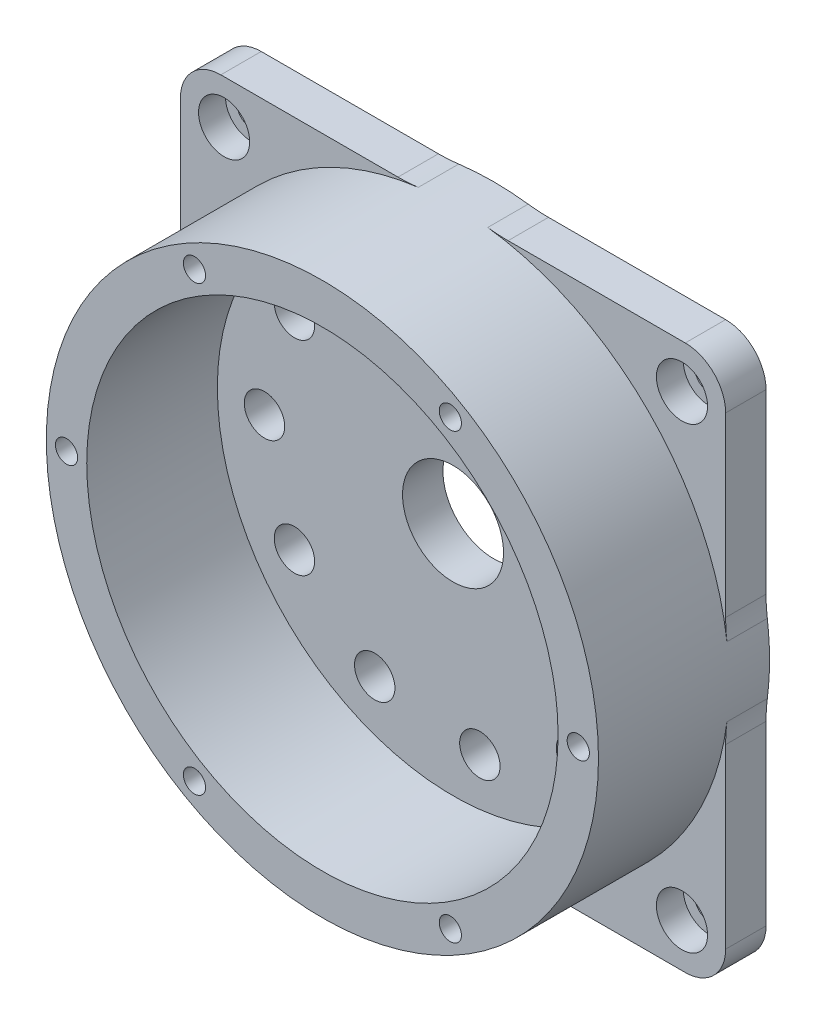
from build123d import *

# Parameters (mm, degrees)
SKETCH1_R                                    = 41
SKETCH1_R_2                                  = 3
BOSS_EXTRUDE1_DEPTH                          = 6
BOSS_EXTRUDE2_START                          = 19.4
SKETCH3_R                                    = 41
SKETCH3_R_2                                  = 35
BOSS_EXTRUDE2_DEPTH                          = 19.4
SKETCH5_R                                    = 7.5
CUT_EXTRUDE1_DEPTH                           = 62.142129502
SKETCH6_R                                    = 1.65
CUT_EXTRUDE2_DEPTH                           = 10
BOSS_EXTRUDE3_START                          = -6
SKETCH7_R                                    = 2.1
BOSS_EXTRUDE3_DEPTH                          = 6
FILLET1_R                                    = 6
FILLET2_R                                    = 24
CBORE_FOR_M4_HEX_HEAD_CAP_SCREW1_D           = 4.2
CBORE_FOR_M4_HEX_HEAD_CAP_SCREW1_CBORE_D     = 7.6
CBORE_FOR_M4_HEX_HEAD_CAP_SCREW1_CBORE_DEPTH = 4
CIRPATTERN1_COUNT                            = 4
FILLET1_OF_CIRPATTERN1_R                     = 6
FILLET2_OF_CIRPATTERN1_R                     = 24


with BuildPart() as part:
    # Sketch1 → Boss-Extrude1 (new body)
    with BuildSketch(Plane(origin=(0, 0, 0), x_dir=(0, 1, 0), z_dir=(0, 0, 1))):
        with Locations(Location((0, 0, 0), (0, 0, 270))):
            Circle(SKETCH1_R)
        with Locations(Location((0, 28, 0), (0, 0, 270))):
            Circle(SKETCH1_R_2, mode=Mode.SUBTRACT)
        with Locations(Location((15.137942889, 23.555098919, 0), (0, 0, 270))):
            Circle(SKETCH1_R_2, mode=Mode.SUBTRACT)
        with Locations(Location((25.46969587, 11.631620364, 0), (0, 0, 270))):
            Circle(SKETCH1_R_2, mode=Mode.SUBTRACT)
        with Locations(Location((27.715000373, -3.984815472, 0), (0, 0, 270))):
            Circle(SKETCH1_R_2, mode=Mode.SUBTRACT)
        with Locations(Location((21.160988082, -18.33610055, 0), (0, 0, 270))):
            Circle(SKETCH1_R_2, mode=Mode.SUBTRACT)
        with Locations(Location((7.888511592, -26.865803261, 0), (0, 0, 270))):
            Circle(SKETCH1_R_2, mode=Mode.SUBTRACT)
        with Locations(Location((-7.888511592, -26.865803261, 0), (0, 0, 270))):
            Circle(SKETCH1_R_2, mode=Mode.SUBTRACT)
        with Locations(Location((-21.160988082, -18.33610055, 0), (0, 0, 270))):
            Circle(SKETCH1_R_2, mode=Mode.SUBTRACT)
        with Locations(Location((-27.715000373, -3.984815472, 0), (0, 0, 270))):
            Circle(SKETCH1_R_2, mode=Mode.SUBTRACT)
        with Locations(Location((-25.46969587, 11.631620364, 0), (0, 0, 270))):
            Circle(SKETCH1_R_2, mode=Mode.SUBTRACT)
        with Locations(Location((-15.137942889, 23.555098919, 0), (0, 0, 270))):
            Circle(SKETCH1_R_2, mode=Mode.SUBTRACT)
    extrude(amount=-BOSS_EXTRUDE1_DEPTH)

    # Sketch3 → Boss-Extrude2 (add)
    with BuildSketch(Plane.XY.offset(BOSS_EXTRUDE2_START)):
        Circle(SKETCH3_R)
        Circle(SKETCH3_R_2, mode=Mode.SUBTRACT)
    extrude(amount=-BOSS_EXTRUDE2_DEPTH)

    # Sketch5 → Cut-Extrude1 (cut, through all)
    with BuildSketch(Plane.XY):
        Circle(SKETCH5_R)
    extrude(amount=-CUT_EXTRUDE1_DEPTH, mode=Mode.SUBTRACT)

    # Sketch6 → Cut-Extrude2 (cut)
    with BuildSketch(Plane.XY.offset(19.4)):
        with Locations((-38, 0)):
            Circle(SKETCH6_R)
        with Locations((-19, 32.908965344)):
            Circle(SKETCH6_R)
        with Locations((19, 32.908965344)):
            Circle(SKETCH6_R)
        with Locations((38, 0)):
            Circle(SKETCH6_R)
        with Locations((19, -32.908965344)):
            Circle(SKETCH6_R)
        with Locations((-19, -32.908965344)):
            Circle(SKETCH6_R)
    extrude(amount=-CUT_EXTRUDE2_DEPTH, mode=Mode.SUBTRACT)

    # Sketch7 → Boss-Extrude3 (add)
    with BuildSketch(Plane(origin=(0, 0, -6), x_dir=(1, 0, 0), z_dir=(0, 0, -1)).offset(BOSS_EXTRUDE3_START)):
        with BuildLine():
            Line((40.484037132, 40.484037132), (6.484037132, 40.484037132))
            ThreePointArc((6.484037132, 40.484037132), (28.991378029, 28.991378029), (40.484037132, 6.484037132))
            Line((40.484037132, 6.484037132), (40.484037132, 40.484037132))
        make_face()
        with Locations(Location((34, 34, 0), (0, 0, 180))):
            Circle(SKETCH7_R, mode=Mode.SUBTRACT)
    boss_extrude3 = extrude(amount=BOSS_EXTRUDE3_DEPTH)

    # Fillet1
    fillet1_edges = [part.edges().sort_by_distance(p)[0] for p in [
        (40.484037132, -40.484037132, -3),
    ]]
    fillet(fillet1_edges, radius=FILLET1_R)

    # Fillet2
    fillet2_edges = [part.edges().sort_by_distance(p)[0] for p in [
        (6.484037132, -40.484037132, -3),
        (40.484037132, -6.484037132, -3),
    ]]
    fillet(fillet2_edges, radius=FILLET2_R)

    # CBORE for M4 Hex Head Cap Screw1 (through all)
    with Locations(Plane.XY):
        with Locations((34, -34)):
            cbore_for_m4_hex_head_cap_screw1 = CounterBoreHole(CBORE_FOR_M4_HEX_HEAD_CAP_SCREW1_D / 2, CBORE_FOR_M4_HEX_HEAD_CAP_SCREW1_CBORE_D / 2, CBORE_FOR_M4_HEX_HEAD_CAP_SCREW1_CBORE_DEPTH)

    # CirPattern1: Boss-Extrude3, CBORE for M4 Hex Head Cap Screw1 ×4 about axis
    cirpattern1_axis = Axis((0, 0, 0), (0, 0, 1))
    add([boss_extrude3.rotate(cirpattern1_axis, i * 360 / CIRPATTERN1_COUNT) for i in range(1, CIRPATTERN1_COUNT)])
    add([cbore_for_m4_hex_head_cap_screw1.rotate(cirpattern1_axis, i * 360 / CIRPATTERN1_COUNT) for i in range(1, CIRPATTERN1_COUNT)], mode=Mode.SUBTRACT)

    # Fillet1 of CirPattern1
    fillet1_of_cirpattern1_edges = [part.edges().sort_by_distance(p)[0] for p in [
        (40.484037132, 40.484037132, -3),
        (-40.484037132, 40.484037132, -3),
        (-40.484037132, -40.484037132, -3),
    ]]
    fillet(fillet1_of_cirpattern1_edges, radius=FILLET1_OF_CIRPATTERN1_R)

    # Fillet2 of CirPattern1
    fillet2_of_cirpattern1_edges = [part.edges().sort_by_distance(p)[0] for p in [
        (40.484037132, 6.484037132, -3),
        (6.484037132, 40.484037132, -3),
        (-6.484037132, 40.484037132, -3),
        (-40.484037132, 6.484037132, -3),
        (-40.484037132, -6.484037132, -3),
        (-6.484037132, -40.484037132, -3),
    ]]
    fillet(fillet2_of_cirpattern1_edges, radius=FILLET2_OF_CIRPATTERN1_R)


solid = part.part
